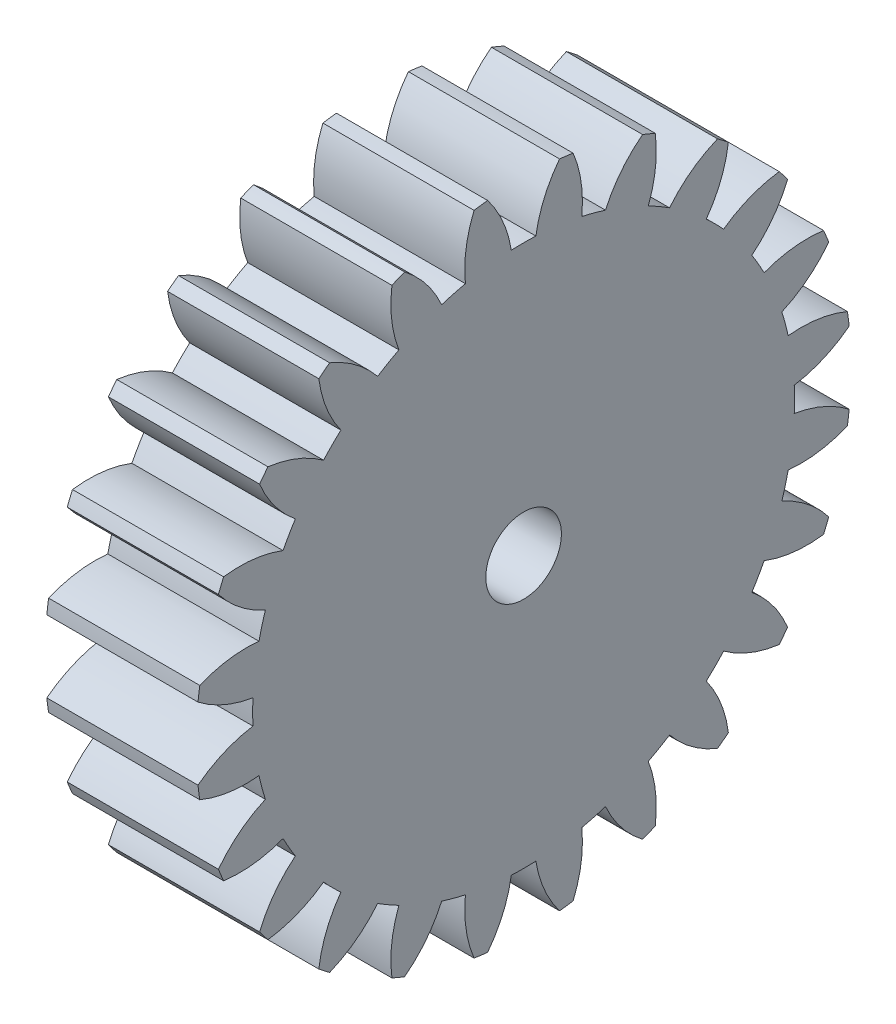
from build123d import *

# Parameters (mm, degrees)
BASPROSKE_W     = 6.35
BASPROSKE_H     = 13.758333333
TOOTHCUT_DEPTH  = 21.467192583
TEETHCUTS_COUNT = 24
TEETHCUTS_ANGLE = 345
BORSKE_R        = 1.5875
BORE_DEPTH      = 50.8000508


with BuildPart() as part:
    # BasProSke → Base-Revolve (revolve)
    with BuildSketch(Plane(origin=(0, 0, 0), x_dir=(1, 0, 0), z_dir=(0, 1, 0)), mode=Mode.PRIVATE) as base_revolve_sk:
        with Locations((3.175, 6.879166667)):
            Rectangle(BASPROSKE_W, BASPROSKE_H)
    revolve(base_revolve_sk.sketch.rotate(Axis((-10, 0, 0), (1, 0, 0)), 180), axis=Axis((-10, 0, 0), (1, 0, 0)))

    # TooCutSke → ToothCut (cut, through all)
    with BuildSketch(Plane(origin=(0, 0, 0), x_dir=(0, 0, -1), z_dir=(1, 0, 0))):
        with BuildLine():
            ThreePointArc((0.515999621, 11.367494756), (0, 11.3792), (-0.515999621, 11.367494756))
            ThreePointArc((-0.515999621, 11.367494756), (-0.87412462, 12.597453573), (-1.528549184, 13.698716801))
            ThreePointArc((-1.528549184, 13.698716801), (0, 13.783733333), (1.528549184, 13.698716801))
            ThreePointArc((1.528549184, 13.698716801), (0.87412462, 12.597453573), (0.515999621, 11.367494756))
        make_face()
    toothcut = extrude(amount=TOOTHCUT_DEPTH, mode=Mode.SUBTRACT)

    # TeethCuts: ToothCut ×24 about axis
    teethcuts_axis = Axis((-10, 0, 0), (1, 0, 0))
    for i in range(1, TEETHCUTS_COUNT):
        add(toothcut.rotate(teethcuts_axis, i * TEETHCUTS_ANGLE / (TEETHCUTS_COUNT - 1)), mode=Mode.SUBTRACT)

    # BorSke → Bore (cut, symmetric)
    with BuildSketch(Plane(origin=(0, 0, 0), x_dir=(0, 0, -1), z_dir=(1, 0, 0))):
        with Locations(Location((0, 0, 0), (0, 0, 180))):
            Circle(BORSKE_R)
    extrude(amount=BORE_DEPTH, both=True, mode=Mode.SUBTRACT)


solid = part.part
